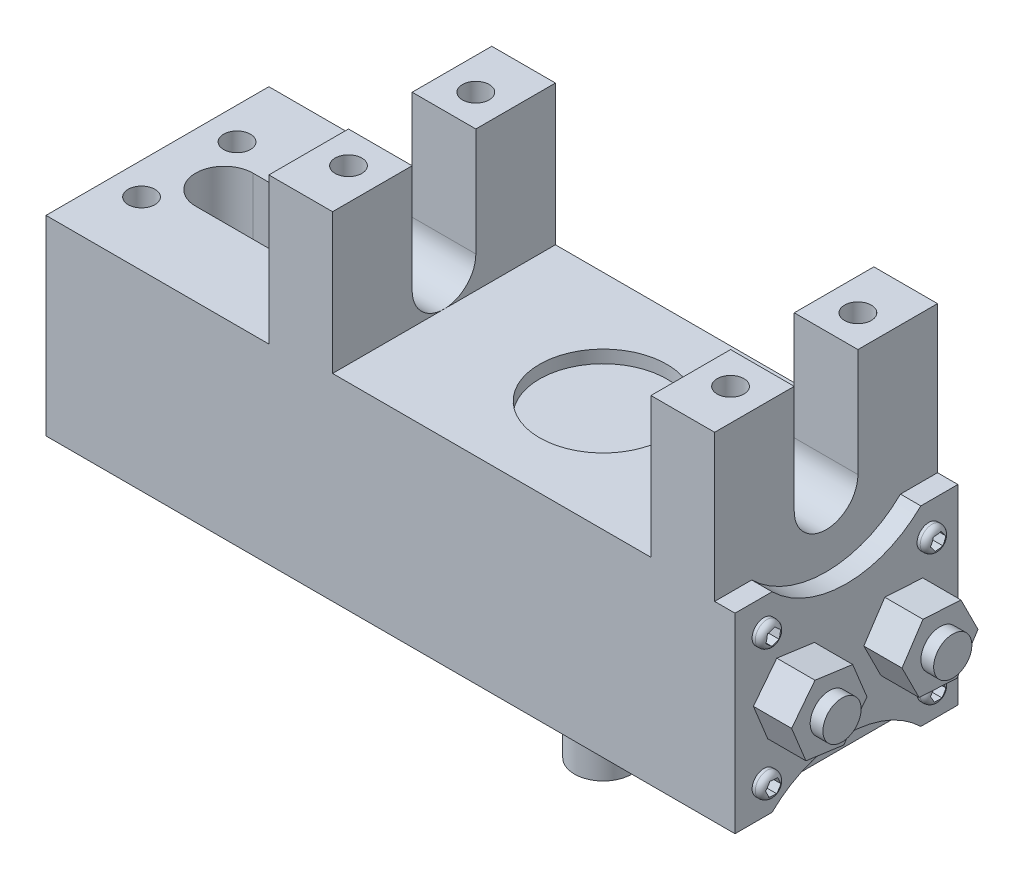
from build123d import *

# Parameters (mm, degrees)
SKETCH_1_W          = 70
SKETCH_1_H          = 35
EXTRUDE_1_DEPTH     = 53
SKETCH_2_W          = 50
SKETCH_2_H          = 22
CUT_EXTRUDE_1_DEPTH = 73.518963037
SKETCH_3_R          = 10
CUT_EXTRUDE_2_DEPTH = 2
SKETCH_4_R          = 14
EXTRUDE_2_DEPTH     = 2
SKETCH_5_R          = 4.5
EXTRUDE_3_DEPTH     = 15.5
CUT_EXTRUDE_3_DEPTH = 90.527928603
M5X0_8_1_D          = 4.2
M5X0_8_1_DEPTH      = 12.4
M5X0_8_1_TIP        = 1.2618073
SKETCH_9_W          = 35
SKETCH_9_H          = 30
EXTRUDE_4_DEPTH     = 3.2
SKETCH_10_R         = 16.738935529
CUT_EXTRUDE_4_DEPTH = 3.2
SKETCH_11_R         = 1.867881689
EXTRUDE_5_DEPTH     = 1.5
FILLET_1_R          = 1
CUT_EXTRUDE_5_DEPTH = 5
SKETCH_13_R         = 3
EXTRUDE_6_DEPTH     = 8
EXTRUDE_7_DEPTH     = 6
SKETCH_15_W         = 35
SKETCH_15_H         = 30
EXTRUDE_8_DEPTH     = 35
CUT_EXTRUDE_6_DEPTH = 35
M5X0_8_2_D          = 4.2
M5X0_8_2_DEPTH      = 12.4
M5X0_8_2_TIP        = 1.2618073
SKETCH_19_R         = 2.5
EXTRUDE_9_DEPTH     = 1.5
FILLET_2_R          = 1
CUT_EXTRUDE_7_DEPTH = 3


with BuildPart() as part:
    # 草图1 → 凸台-拉伸1 (new body)
    with BuildSketch(Plane(origin=(0, 0, 0), x_dir=(1, 0, 0), z_dir=(0, 1, 0))):
        Rectangle(SKETCH_1_W, SKETCH_1_H)
    extrude(amount=EXTRUDE_1_DEPTH)

    # 草图2 → 切除-拉伸1 (cut, through all)
    with BuildSketch(Plane.XY.offset(17.5)):
        with Locations((0, 42)):
            Rectangle(SKETCH_2_W, SKETCH_2_H)
    extrude(amount=-CUT_EXTRUDE_1_DEPTH, mode=Mode.SUBTRACT)

    # 草图3 → 切除-拉伸2 (cut)
    with BuildSketch(Plane(origin=(0, 31, 0), x_dir=(1, 0, 0), z_dir=(0, 1, 0))):
        with Locations(Location((0, 0, 0), (0, 0, 270))):
            Circle(SKETCH_3_R)
    extrude(amount=-CUT_EXTRUDE_2_DEPTH, mode=Mode.SUBTRACT)

    # 草图4 → 凸台-拉伸2 (add)
    with BuildSketch(Plane.XZ):
        with Locations(Location((0, 0, 0), (0, 0, 90))):
            Circle(SKETCH_4_R)
    extrude(amount=EXTRUDE_2_DEPTH)

    # 草图5 → 凸台-拉伸3 (add)
    with BuildSketch(Plane.XZ.offset(2)):
        with Locations(Location((0, 0, 0), (0, 0, 270))):
            Circle(SKETCH_5_R)
    extrude(amount=EXTRUDE_3_DEPTH)

    # 草图6 → 切除-拉伸3 (cut, through all)
    with BuildSketch(Plane(origin=(35, 0, 0), x_dir=(0, 0, -1), z_dir=(1, 0, 0))):
        with BuildLine():
            Line((-5, 53), (-5, 36))
            ThreePointArc((-5, 36), (0, 31), (5, 36))
            Line((5, 36), (5, 53))
            Line((5, 53), (-5, 53))
        make_face()
    extrude(amount=-CUT_EXTRUDE_3_DEPTH, mode=Mode.SUBTRACT)

    # M5x0.8 螺纹孔1
    with Locations(Plane(origin=(0, 53, 0), x_dir=(-1, 0, 0), z_dir=(0, 1, 0))):
        with Locations((-30, -10), (30, -10), (30, 10), (-30, 10)):
            Hole(M5X0_8_1_D / 2, depth=M5X0_8_1_DEPTH)
            with Locations((0, 0, -(M5X0_8_1_DEPTH + M5X0_8_1_TIP / 2))):  # 118° drill point
                Cone(0, M5X0_8_1_D / 2, M5X0_8_1_TIP, mode=Mode.SUBTRACT)

    # 草图9 → 凸台-拉伸4 (add)
    with BuildSketch(Plane(origin=(35, 0, 0), x_dir=(0, 0, -1), z_dir=(1, 0, 0))):
        with Locations((0, 15)):
            Rectangle(SKETCH_9_W, SKETCH_9_H)
    extrude(amount=EXTRUDE_4_DEPTH)

    # 草图10 → 切除-拉伸4 (cut)
    with BuildSketch(Plane(origin=(38.2, 0, 0), x_dir=(0, 0, -1), z_dir=(1, 0, 0))):
        with Locations((0, 41.989644799)):
            Circle(SKETCH_10_R)
        with Locations((0, -11.989644799)):
            Circle(SKETCH_10_R)
    extrude(amount=-CUT_EXTRUDE_4_DEPTH, mode=Mode.SUBTRACT)

    # 草图11 → 凸台-拉伸5 (add)
    with BuildSketch(Plane(origin=(38.2, 0, 0), x_dir=(0, 0, -1), z_dir=(1, 0, 0))):
        with Locations((-12.950749665, 25.256095692)):
            Circle(SKETCH_11_R)
        with Locations(Location((-12.950749665, 4.743904308, 0), (0, 0, 180))):
            Circle(SKETCH_11_R)
        with Locations((12.950749665, 4.743904308)):
            Circle(SKETCH_11_R)
        with Locations(Location((12.950749665, 25.256095692, 0), (0, 0, 180))):
            Circle(SKETCH_11_R)
    extrude(amount=EXTRUDE_5_DEPTH)

    # 圆角1
    fillet_1_edges = [part.edges().sort_by_distance(p)[0] for p in [
        (39.7, 25.256095692, 14.818631354),
        (39.7, 4.743904308, 11.082867977),
        (39.7, 4.743904308, -11.082867977),
        (39.7, 25.256095692, -14.818631354),
    ]]
    fillet(fillet_1_edges, radius=FILLET_1_R)

    # 草图12 → 切除-拉伸5 (cut)
    with BuildSketch(Plane(origin=(39.7, 0, 0), x_dir=(0, 0, -1), z_dir=(1, 0, 0))):
        Polygon((-12.710761309, 26.449023685), (-13.863861434, 26.060395702), (-14.10384979, 24.867467708), (-13.190738022, 24.063167698), (-12.037637896, 24.451795681), (-11.79764954, 25.644723675), align=None)
        Polygon((13.416811382, 26.380132206), (12.210336347, 26.221735235), (11.744274631, 25.097698721), (12.484687949, 24.132059177), (13.691162983, 24.290456148), (14.157224699, 25.414492662), align=None)
        Polygon((13.570199566, 5.791259754), (12.353438193, 5.804041382), (11.733988292, 4.756685936), (12.331299764, 3.696548863), (13.548061137, 3.683767235), (14.167511038, 4.731122681), align=None)
        Polygon((-12.261537213, 5.746729221), (-13.474615289, 5.842192257), (-14.163827741, 4.839367344), (-13.639962117, 3.741079396), (-12.426884041, 3.64561636), (-11.737671589, 4.648441273), align=None)
    extrude(amount=-CUT_EXTRUDE_5_DEPTH, mode=Mode.SUBTRACT)

    # 草图13 → 凸台-拉伸6 (add)
    with BuildSketch(Plane(origin=(38.2, 0, 0), x_dir=(0, 0, -1), z_dir=(1, 0, 0))):
        with Locations((-8.693192055, 15.066987909)):
            Circle(SKETCH_13_R)
        with Locations(Location((8.693192055, 15.066987909, 0), (0, 0, 180))):
            Circle(SKETCH_13_R)
    extrude(amount=EXTRUDE_6_DEPTH)

    # 草图14 → 凸台-拉伸7 (add)
    with BuildSketch(Plane(origin=(38.2, 0, 0), x_dir=(0, 0, -1), z_dir=(1, 0, 0))):
        Polygon((-5.02389665, 19.782237151), (-10.942069982, 20.602315565), (-14.611365387, 15.887066323), (-12.362487461, 10.351738666), (-6.444314129, 9.531660252), (-2.775018723, 14.246909495), align=None)
        Polygon((11.981161463, 20.055631148), (6.016884984, 20.408774562), (2.728915576, 15.420131323), (5.405222648, 10.07834467), (11.369499127, 9.725201255), (14.657468535, 14.713844495), align=None)
    extrude(amount=EXTRUDE_7_DEPTH)

    # 草图15 → 凸台-拉伸8 (add)
    with BuildSketch(Plane.ZY.offset(35)):
        with Locations((0, 15)):
            Rectangle(SKETCH_15_W, SKETCH_15_H)
    extrude(amount=EXTRUDE_8_DEPTH)

    # 草图16 → 切除-拉伸6 (cut)
    with BuildSketch(Plane(origin=(0, 30, 0), x_dir=(1, 0, 0), z_dir=(0, 1, 0))):
        with BuildLine():
            Line((-59.5, 4.5), (-45.5, 4.5))
            ThreePointArc((-45.5, 4.5), (-41, 0), (-45.5, -4.5))
            Line((-45.5, -4.5), (-59.5, -4.5))
            ThreePointArc((-59.5, -4.5), (-64, 0), (-59.5, 4.5))
        make_face()
    extrude(amount=-CUT_EXTRUDE_6_DEPTH, mode=Mode.SUBTRACT)

    # M5x0.8 螺纹孔2
    with Locations(Plane(origin=(0, 30, 0), x_dir=(-1, 0, 0), z_dir=(0, 1, 0))):
        with Locations((65, -7.5), (65, 7.5)):
            Hole(M5X0_8_2_D / 2, depth=M5X0_8_2_DEPTH)
            with Locations((0, 0, -(M5X0_8_2_DEPTH + M5X0_8_2_TIP / 2))):  # 118° drill point
                Cone(0, M5X0_8_2_D / 2, M5X0_8_2_TIP, mode=Mode.SUBTRACT)

    # 草图19 → 凸台-拉伸9 (add)
    with BuildSketch(Plane.ZY.offset(70)):
        with Locations(Location((-12.26584551, 25.044962724, 0), (0, 0, 180))):
            Circle(SKETCH_19_R)
        with Locations(Location((-12.26584551, 4.955037276, 0), (0, 0, 180))):
            Circle(SKETCH_19_R)
        with Locations(Location((12.26584551, 4.955037276, 0), (0, 0, 180))):
            Circle(SKETCH_19_R)
        with Locations(Location((12.26584551, 25.044962724, 0), (0, 0, 180))):
            Circle(SKETCH_19_R)
    extrude(amount=EXTRUDE_9_DEPTH)

    # 圆角2
    fillet_2_edges = [part.edges().sort_by_distance(p)[0] for p in [
        (-71.5, 25.044962724, -9.76584551),
        (-71.5, 4.955037276, -9.76584551),
        (-71.5, 4.955037276, 14.76584551),
        (-71.5, 25.044962724, 14.76584551),
    ]]
    fillet(fillet_2_edges, radius=FILLET_2_R)

    # 草图20 → 切除-拉伸7 (cut)
    with BuildSketch(Plane.ZY.offset(71.5)):
        Polygon((-12.26584551, 26.190776132), (-13.258149029, 25.617869428), (-13.258149029, 24.472056021), (-12.26584551, 23.899149317), (-11.273541991, 24.472056021), (-11.273541991, 25.617869428), align=None)
        Polygon((13.166333868, 25.617869428), (12.148855758, 26.234379802), (11.106203058, 25.661473098), (11.081028467, 24.472056021), (12.098506577, 23.855545647), (13.141159277, 24.428452351), align=None)
        Polygon((12.657594813, 5.9756174), (11.577871847, 5.804592186), (11.186122544, 4.784012062), (11.874096207, 3.934457151), (12.953819173, 4.105482365), (13.345568476, 5.12606249), align=None)
        Polygon((-11.530047659, 5.804592186), (-12.633682719, 6.017034362), (-13.36948057, 5.167479451), (-13.001643361, 4.105482365), (-11.898008301, 3.893040189), (-11.16221045, 4.7425951), align=None)
    extrude(amount=-CUT_EXTRUDE_7_DEPTH, mode=Mode.SUBTRACT)


solid = part.part
